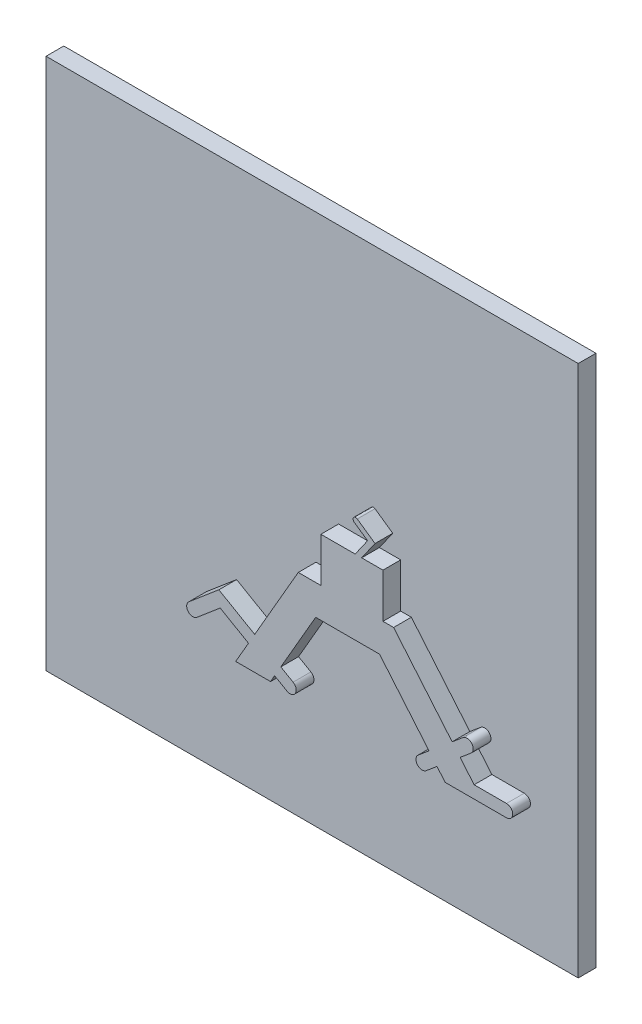
from build123d import *

# Parameters (mm, degrees)
SKICA1_W                = 300
SKICA1_H                = 300
P_IDAT_VYSUNUT_M1_DEPTH = 10
P_IDAT_VYSUNUT_M3_DEPTH = 10


with BuildPart() as part:
    # Skica1 → Přidat vysunutím1 (new body)
    with BuildSketch(Plane.XY):
        with Locations((150, 150)):
            Rectangle(SKICA1_W, SKICA1_H)
    extrude(amount=P_IDAT_VYSUNUT_M1_DEPTH)

    # Skica3 → Přidat vysunutím3 (add)
    with BuildSketch(Plane.XY.offset(10)):
        with BuildLine():
            Line((116.91189832, 68), (124.126552838, 80.496148184))
            Line((124.126552838, 80.496148184), (108.180545378, 89.702579884))
            Line((108.180545378, 89.702579884), (95.03783106, 78.576572328))
            ThreePointArc((95.03783106, 78.576572328), (90.105085693, 78.986478585), (90.514991949, 83.919223952))
            Line((90.514991949, 83.919223952), (107.416046941, 98.226867031))
            Line((107.416046941, 98.226867031), (127.626552838, 86.55832601))
            Line((127.626552838, 86.55832601), (152.185045424, 129.094882926))
            Line((152.185045424, 129.094882926), (164.927230189, 129.094882926))
            Line((164.927230189, 129.094882926), (164.927230189, 154.094882926))
            Line((164.927230189, 154.094882926), (184.264906422, 154.094882926))
            Line((184.264906422, 154.094882926), (191.266981804, 164.094882926))
            Line((191.266981804, 164.094882926), (183.724437937, 169.376228999))
            ThreePointArc((183.724437937, 169.376228999), (183.356074525, 171.46532172), (185.445167246, 171.833685132))
            Line((185.445167246, 171.833685132), (195.445167246, 164.83160975))
            Line((195.445167246, 164.83160975), (187.927230189, 154.094882926))
            Line((187.927230189, 154.094882926), (199.927230189, 154.094882926))
            Line((199.927230189, 154.094882926), (199.927230189, 129.094882926))
            Line((199.927230189, 129.094882926), (205.927230189, 129.094882926))
            Line((205.927230189, 129.094882926), (238.917942598, 89.77808289))
            Line((238.917942598, 89.77808289), (245.046298143, 94.920383768))
            ThreePointArc((245.046298143, 94.920383768), (249.977210328, 94.488984851), (249.54581141, 89.558072666))
            Line((249.54581141, 89.558072666), (243.417455866, 84.415771788))
            Line((243.417455866, 84.415771788), (251.3182265, 75))
            Line((251.3182265, 75), (269.579798581, 75))
            ThreePointArc((269.579798581, 75), (273.079798581, 71.5), (269.579798581, 68))
            Line((269.579798581, 68), (235, 68))
            Line((235, 68), (230.394700333, 73.488382424))
            Line((230.394700333, 73.488382424), (224.266344788, 68.346081546))
            ThreePointArc((224.266344788, 68.346081546), (219.335432603, 68.777480463), (219.76683152, 73.708392648))
            Line((219.76683152, 73.708392648), (225.895187065, 78.850693526))
            Line((225.895187065, 78.850693526), (198, 112.094882926))
            Line((198, 112.094882926), (162, 112.094882926))
            Line((162, 112.094882926), (142.348984702, 78.05832601))
            Line((142.348984702, 78.05832601), (149.277187933, 74.05832601))
            ThreePointArc((149.277187933, 74.05832601), (150.558276846, 69.277237097), (145.777187933, 67.996148184))
            Line((145.777187933, 67.996148184), (138.848984702, 71.996148184))
            Line((138.848984702, 71.996148184), (136.541807473, 68))
            Line((136.541807473, 68), (116.91189832, 68))
        make_face()
    extrude(amount=P_IDAT_VYSUNUT_M3_DEPTH)


solid = part.part
